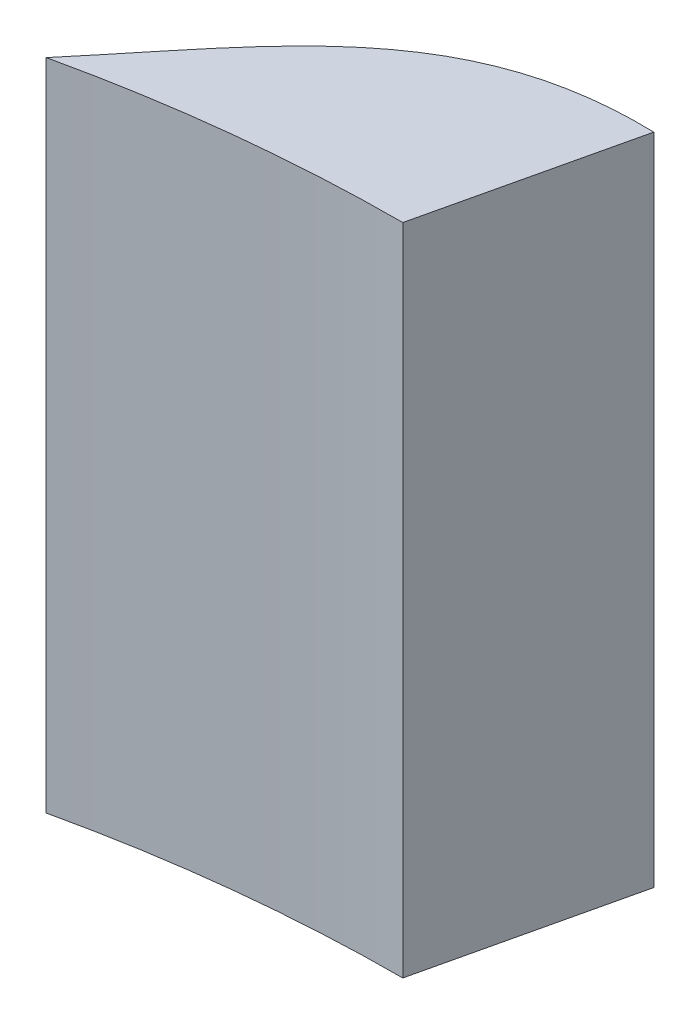
from build123d import *

# Parameters (mm, degrees)
BOSS_EXTRUDE1_DEPTH = 40


with BuildPart() as part:
    # Sketch1 → Boss-Extrude1 (new body)
    with BuildSketch(Plane(origin=(0, 0, 0), x_dir=(1, 0, 0), z_dir=(0, 1, 0))):
        with BuildLine():
            Line((0, 90), (2.88338767, 102.459436245))
            add(Edge.make_bspline(
                [(2.88338767, 102.459436245), (-8.960842785, 102.792753597), (-13.226606766, 95.391928468), (-19.632973525, 87.83249029)],
                knots=[0, 0, 0, 0, 1, 1, 1, 1], degree=3))
            ThreePointArc((-19.632973525, 87.83249029), (-9.876129654, 89.456481392), (0, 90))
        make_face()
    extrude(amount=BOSS_EXTRUDE1_DEPTH)


solid = part.part
